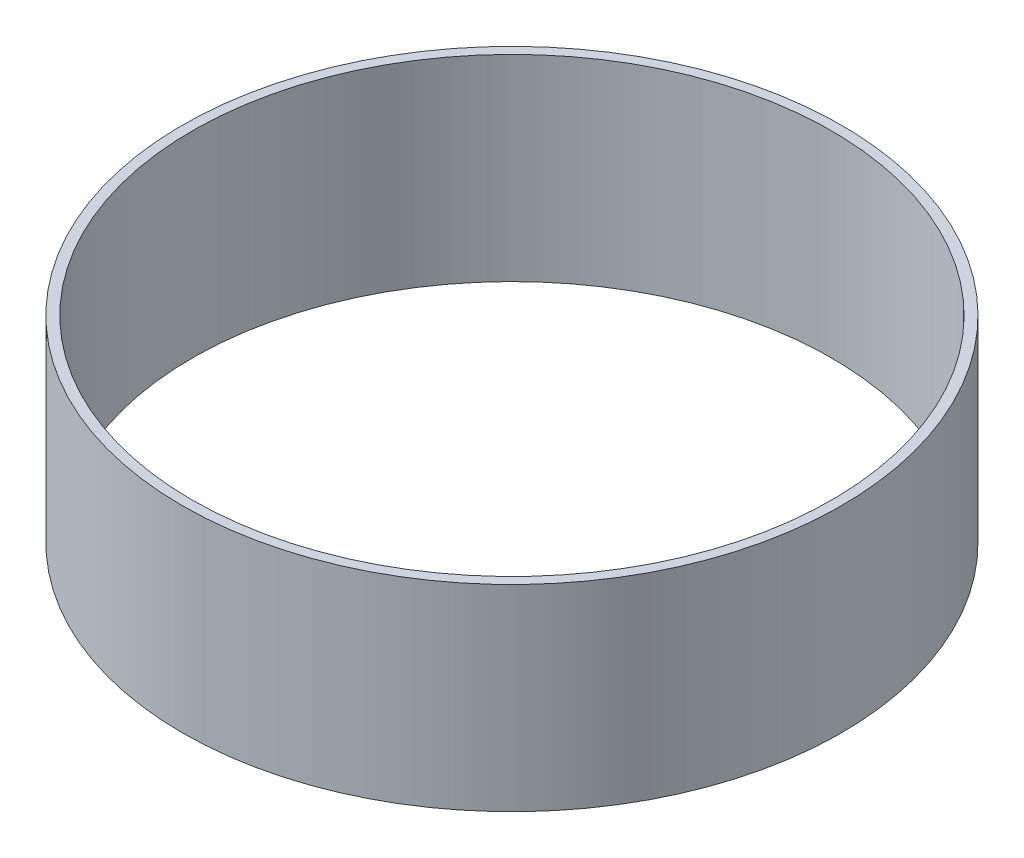
from build123d import *

# Parameters (mm, degrees)
SKETCH1_R           = 5105.4
SKETCH1_R_2         = 4953
BOSS_EXTRUDE1_DEPTH = 3048


with BuildPart() as part:
    # Sketch1 → Boss-Extrude1 (new body)
    with BuildSketch(Plane(origin=(0, 0, 0), x_dir=(1, 0, 0), z_dir=(0, 1, 0))):
        with Locations(Location((0, 0, 0), (0, 0, 270))):
            Circle(SKETCH1_R)
        with Locations(Location((0, 0, 0), (0, 0, 270))):
            Circle(SKETCH1_R_2, mode=Mode.SUBTRACT)
    extrude(amount=BOSS_EXTRUDE1_DEPTH)


solid = part.part
